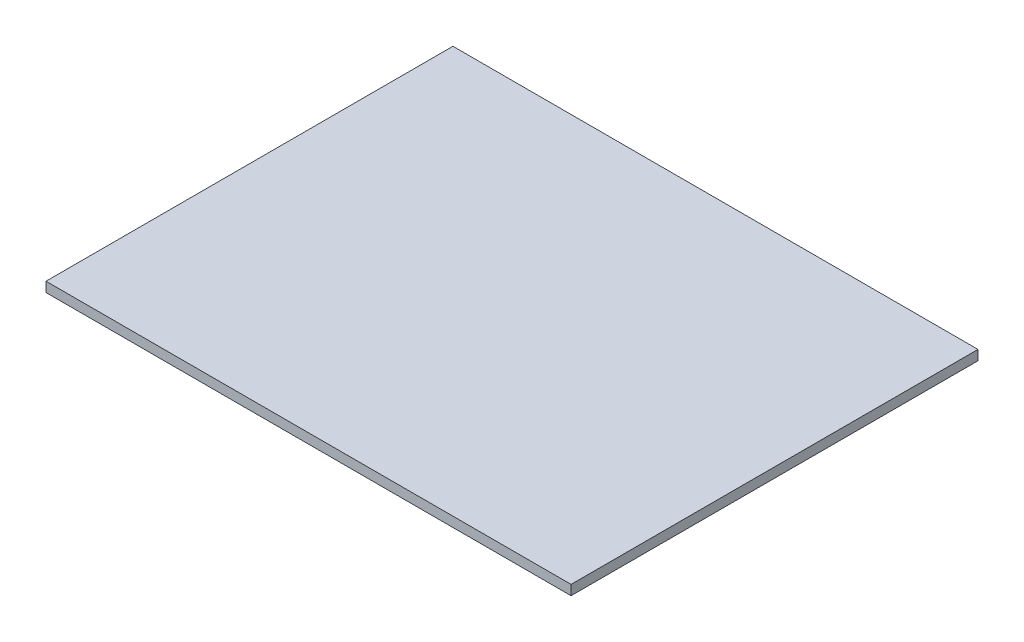
from build123d import *

# Parameters (mm, degrees)
SKETCH_1_W      = 800
SKETCH_1_H      = 620
EXTRUDE_1_DEPTH = 15


with BuildPart() as part:
    # 草图1 → 凸台-拉伸1 (new body)
    with BuildSketch(Plane(origin=(0, 0, 0), x_dir=(1, 0, 0), z_dir=(0, 1, 0))):
        with Locations((0, 310)):
            Rectangle(SKETCH_1_W, SKETCH_1_H)
    extrude(amount=EXTRUDE_1_DEPTH)


solid = part.part
